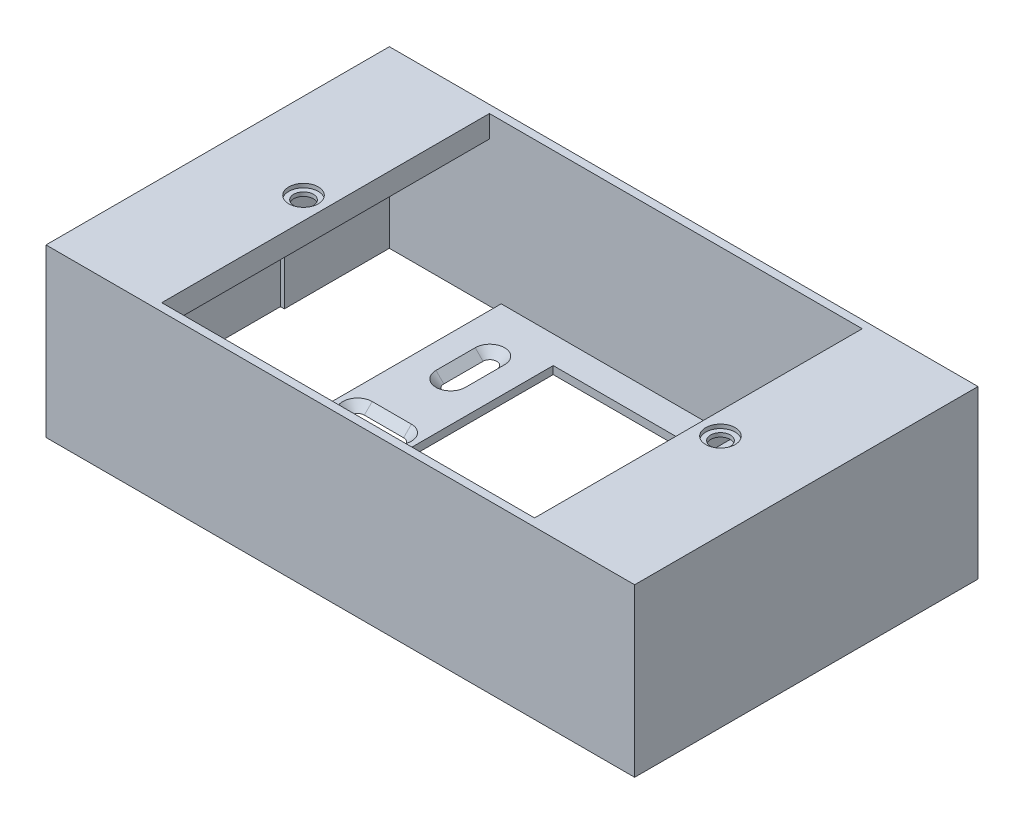
from build123d import *

# Parameters (mm, degrees)
SKETCH1_W                    = 120
SKETCH1_H                    = 70
BOSS_EXTRUDE1_DEPTH          = 34
SHELL1_T                     = -1.6
CUT_EXTRUDE1_REACH           = 79.337
SKETCH2_W                    = 76
SKETCH2_H                    = 66.8
SKETCH3_W                    = 1.6
SKETCH3_H                    = 70
BOSS_EXTRUDE2_DEPTH          = 4.5
SKETCH4_R                    = 3
CUT_EXTRUDE2_DEPTH           = 0.8
CUT_EXTRUDE3_REACH           = 79.337
SKETCH5_R                    = 2
SKETCH7_W                    = 71.2
SKETCH7_H                    = 66.8
SKETCH7_W_2                  = 38.8
SKETCH7_H_2                  = 55.6
BOSS_EXTRUDE3_DEPTH          = 1.6
CUT_EXTRUDE4_DEPTH           = 1.6
CUT_EXTRUDE4_DRAFT           = -45
CUT_EXTRUDE4_PROFILE_2_DEPTH = 1.6
CUT_EXTRUDE4_PROFILE_2_DRAFT = -45
CUT_EXTRUDE4_PROFILE_3_DEPTH = 1.6
CUT_EXTRUDE4_PROFILE_3_DRAFT = -45
CUT_EXTRUDE4_PROFILE_4_DEPTH = 1.6
CUT_EXTRUDE4_PROFILE_4_DRAFT = -45
CUT_EXTRUDE4_PROFILE_5_DEPTH = 1.6
CUT_EXTRUDE4_PROFILE_5_DRAFT = -45
CUT_EXTRUDE4_PROFILE_6_DEPTH = 1.6
CUT_EXTRUDE4_PROFILE_6_DRAFT = -45
CUT_EXTRUDE5_START           = -1.6
SKETCH9_W                    = 24
SKETCH9_H                    = 12
CUT_EXTRUDE5_DEPTH           = 0.8


with BuildPart() as part:
    # Sketch1 → Boss-Extrude1 (new body)
    with BuildSketch(Plane(origin=(0, 0, 0), x_dir=(1, 0, 0), z_dir=(0, 1, 0))):
        Rectangle(SKETCH1_W, SKETCH1_H)
    extrude(amount=BOSS_EXTRUDE1_DEPTH)

    # Shell1
    shell1_openings = [part.faces().sort_by_distance(p)[0] for p in [
        (0, 0, 0),
    ]]
    offset(amount=SHELL1_T, openings=shell1_openings, kind=Kind.INTERSECTION)

    # Sketch2 → Cut-Extrude1 (cut, up to next)
    with BuildSketch(Plane(origin=(0, 34, 0), x_dir=(1, 0, 0), z_dir=(0, 1, 0)), mode=Mode.PRIVATE) as cut_extrude1_sk1:
        Rectangle(SKETCH2_W, SKETCH2_H)
    cut_extrude1_tool1 = extrude(cut_extrude1_sk1.sketch, amount=-CUT_EXTRUDE1_REACH, mode=Mode.PRIVATE) & part.part
    add(cut_extrude1_tool1.solids().sort_by_distance((0, 34, 0))[0], mode=Mode.SUBTRACT)

    # Sketch3 → Boss-Extrude2 (add)
    with BuildSketch(Plane(origin=(0, 34, 0), x_dir=(1, 0, 0), z_dir=(0, 1, 0))):
        with Locations((-38.8, 0)):
            Rectangle(SKETCH3_W, SKETCH3_H)
    boss_extrude2 = extrude(amount=-BOSS_EXTRUDE2_DEPTH)

    # Sketch4 → Cut-Extrude2 (cut)
    with BuildSketch(Plane(origin=(0, 34, 0), x_dir=(1, 0, 0), z_dir=(0, 1, 0))):
        with Locations(Location((-42.5, 0, 0), (0, 0, 270))):
            Circle(SKETCH4_R)
    cut_extrude2 = extrude(amount=-CUT_EXTRUDE2_DEPTH, mode=Mode.SUBTRACT)

    # Sketch5 → Cut-Extrude3 (cut, up to next)
    with BuildSketch(Plane(origin=(0, 34, 0), x_dir=(1, 0, 0), z_dir=(0, 1, 0)), mode=Mode.PRIVATE) as cut_extrude3_sk1:
        with Locations(Location((-42.5, 0, 0), (0, 0, 270))):
            Circle(SKETCH5_R)
    cut_extrude3_tool1 = extrude(cut_extrude3_sk1.sketch, amount=-CUT_EXTRUDE3_REACH, mode=Mode.PRIVATE) & part.part
    cut_extrude3 = cut_extrude3_tool1.solids().sort_by_distance((-42.5, 34, 0))[0]
    add(cut_extrude3, mode=Mode.SUBTRACT)

    # Mirror1: Boss-Extrude2, Cut-Extrude2, Cut-Extrude3 across plane
    add(boss_extrude2.mirror(Plane(origin=(0, 0, 0), x_dir=(0, 0, 1), z_dir=(1, 0, 0))))
    add(cut_extrude2.mirror(Plane(origin=(0, 0, 0), x_dir=(0, 0, 1), z_dir=(1, 0, 0))), mode=Mode.SUBTRACT)
    add(cut_extrude3.mirror(Plane(origin=(0, 0, 0), x_dir=(0, 0, 1), z_dir=(1, 0, 0))), mode=Mode.SUBTRACT)

    # Sketch7 → Boss-Extrude3 (add)
    with BuildSketch(Plane(origin=(0, 0, 0), x_dir=(1, 0, 0), z_dir=(0, 1, 0))):
        Rectangle(SKETCH7_W, SKETCH7_H)
        Rectangle(SKETCH7_W_2, SKETCH7_H_2, mode=Mode.SUBTRACT)
    extrude(amount=BOSS_EXTRUDE3_DEPTH)


with BuildPart() as cut_extrude4_tool:
    # Sketch8 → Cut-Extrude4 (with draft: the straight prism first)
    with BuildSketch(Plane(origin=(0, 1.6, 0), x_dir=(1, 0, 0), z_dir=(0, 1, 0))):
        with BuildLine():
            ThreePointArc((-31.5, 3), (-34.5, 0), (-31.5, -3))
            Line((-31.5, -3), (-23.5, -3))
            ThreePointArc((-23.5, -3), (-20.5, 0), (-23.5, 3))
            Line((-23.5, 3), (-31.5, 3))
        make_face()
    extrude(amount=-CUT_EXTRUDE4_DEPTH)
    # Cut-Extrude4: the draft: its side faces are tilted about the plane it starts from
    cut_extrude4_sides = [cut_extrude4_tool.faces().sort_by_distance(p)[0] for p in [
        (-20.5, 0.8, 0),
        (-27.5, 0.8, -3),
        (-34.5, 0.8, 0),
        (-27.5, 0.8, 3),
    ]]
    draft(cut_extrude4_sides, Plane(origin=(0, 1.6, 0), x_dir=(1, 0, 0), z_dir=(0, 1, 0)), CUT_EXTRUDE4_DRAFT)


with BuildPart() as part_1:
    add(part.part)

    # Cut-Extrude4: cut by cut_extrude4_tool
    add(cut_extrude4_tool.part, mode=Mode.SUBTRACT)


with BuildPart() as cut_extrude4_profile_2_tool:
    # Sketch8 → Cut-Extrude4 profile 2 (with draft: the straight prism first)
    with BuildSketch(Plane(origin=(0, 1.6, 0), x_dir=(1, 0, 0), z_dir=(0, 1, 0))):
        with BuildLine():
            ThreePointArc((24.5, -4), (27.5, -7), (30.5, -4))
            Line((30.5, -4), (30.5, 4))
            ThreePointArc((30.5, 4), (27.5, 7), (24.5, 4))
            Line((24.5, 4), (24.5, -4))
        make_face()
    extrude(amount=-CUT_EXTRUDE4_PROFILE_2_DEPTH)
    # Cut-Extrude4 profile 2: the draft: its side faces are tilted about the plane it starts from
    cut_extrude4_profile_2_sides = [cut_extrude4_profile_2_tool.faces().sort_by_distance(p)[0] for p in [
        (27.5, 0.8, -7),
        (24.5, 0.8, 0),
        (27.5, 0.8, 7),
        (30.5, 0.8, 0),
    ]]
    draft(cut_extrude4_profile_2_sides, Plane(origin=(0, 1.6, 0), x_dir=(1, 0, 0), z_dir=(0, 1, 0)), CUT_EXTRUDE4_PROFILE_2_DRAFT)


with BuildPart() as part_2:
    add(part_1.part)

    # Cut-Extrude4 profile 2: cut by cut_extrude4_profile_2_tool
    add(cut_extrude4_profile_2_tool.part, mode=Mode.SUBTRACT)


with BuildPart() as cut_extrude4_profile_3_tool:
    # Sketch8 → Cut-Extrude4 profile 3 (with draft: the straight prism first)
    with BuildSketch(Plane(origin=(0, 1.6, 0), x_dir=(1, 0, 0), z_dir=(0, 1, 0))):
        with BuildLine():
            ThreePointArc((23.5, 22), (20.5, 19), (23.5, 16))
            Line((23.5, 16), (31.5, 16))
            ThreePointArc((31.5, 16), (34.5, 19), (31.5, 22))
            Line((31.5, 22), (23.5, 22))
        make_face()
    extrude(amount=-CUT_EXTRUDE4_PROFILE_3_DEPTH)
    # Cut-Extrude4 profile 3: the draft: its side faces are tilted about the plane it starts from
    cut_extrude4_profile_3_sides = [cut_extrude4_profile_3_tool.faces().sort_by_distance(p)[0] for p in [
        (34.5, 0.8, -19),
        (27.5, 0.8, -22),
        (20.5, 0.8, -19),
        (27.5, 0.8, -16),
    ]]
    draft(cut_extrude4_profile_3_sides, Plane(origin=(0, 1.6, 0), x_dir=(1, 0, 0), z_dir=(0, 1, 0)), CUT_EXTRUDE4_PROFILE_3_DRAFT)


with BuildPart() as part_3:
    add(part_2.part)

    # Cut-Extrude4 profile 3: cut by cut_extrude4_profile_3_tool
    add(cut_extrude4_profile_3_tool.part, mode=Mode.SUBTRACT)


with BuildPart() as cut_extrude4_profile_4_tool:
    # Sketch8 → Cut-Extrude4 profile 4 (with draft: the straight prism first)
    with BuildSketch(Plane(origin=(0, 1.6, 0), x_dir=(1, 0, 0), z_dir=(0, 1, 0))):
        with BuildLine():
            ThreePointArc((23.5, -16), (20.5, -19), (23.5, -22))
            Line((23.5, -22), (31.5, -22))
            ThreePointArc((31.5, -22), (34.5, -19), (31.5, -16))
            Line((31.5, -16), (23.5, -16))
        make_face()
    extrude(amount=-CUT_EXTRUDE4_PROFILE_4_DEPTH)
    # Cut-Extrude4 profile 4: the draft: its side faces are tilted about the plane it starts from
    cut_extrude4_profile_4_sides = [cut_extrude4_profile_4_tool.faces().sort_by_distance(p)[0] for p in [
        (34.5, 0.8, 19),
        (27.5, 0.8, 16),
        (20.5, 0.8, 19),
        (27.5, 0.8, 22),
    ]]
    draft(cut_extrude4_profile_4_sides, Plane(origin=(0, 1.6, 0), x_dir=(1, 0, 0), z_dir=(0, 1, 0)), CUT_EXTRUDE4_PROFILE_4_DRAFT)


with BuildPart() as part_4:
    add(part_3.part)

    # Cut-Extrude4 profile 4: cut by cut_extrude4_profile_4_tool
    add(cut_extrude4_profile_4_tool.part, mode=Mode.SUBTRACT)


with BuildPart() as cut_extrude4_profile_5_tool:
    # Sketch8 → Cut-Extrude4 profile 5 (with draft: the straight prism first)
    with BuildSketch(Plane(origin=(0, 1.6, 0), x_dir=(1, 0, 0), z_dir=(0, 1, 0))):
        with BuildLine():
            ThreePointArc((-30.5, 15), (-27.5, 12), (-24.5, 15))
            Line((-24.5, 15), (-24.5, 23))
            ThreePointArc((-24.5, 23), (-27.5, 26), (-30.5, 23))
            Line((-30.5, 23), (-30.5, 15))
        make_face()
    extrude(amount=-CUT_EXTRUDE4_PROFILE_5_DEPTH)
    # Cut-Extrude4 profile 5: the draft: its side faces are tilted about the plane it starts from
    cut_extrude4_profile_5_sides = [cut_extrude4_profile_5_tool.faces().sort_by_distance(p)[0] for p in [
        (-24.5, 0.8, -19),
        (-27.5, 0.8, -26),
        (-30.5, 0.8, -19),
        (-27.5, 0.8, -12),
    ]]
    draft(cut_extrude4_profile_5_sides, Plane(origin=(0, 1.6, 0), x_dir=(1, 0, 0), z_dir=(0, 1, 0)), CUT_EXTRUDE4_PROFILE_5_DRAFT)


with BuildPart() as part_5:
    add(part_4.part)

    # Cut-Extrude4 profile 5: cut by cut_extrude4_profile_5_tool
    add(cut_extrude4_profile_5_tool.part, mode=Mode.SUBTRACT)


with BuildPart() as cut_extrude4_profile_6_tool:
    # Sketch8 → Cut-Extrude4 profile 6 (with draft: the straight prism first)
    with BuildSketch(Plane(origin=(0, 1.6, 0), x_dir=(1, 0, 0), z_dir=(0, 1, 0))):
        with BuildLine():
            ThreePointArc((-30.5, -23), (-27.5, -26), (-24.5, -23))
            Line((-24.5, -23), (-24.5, -15))
            ThreePointArc((-24.5, -15), (-27.5, -12), (-30.5, -15))
            Line((-30.5, -15), (-30.5, -23))
        make_face()
    extrude(amount=-CUT_EXTRUDE4_PROFILE_6_DEPTH)
    # Cut-Extrude4 profile 6: the draft: its side faces are tilted about the plane it starts from
    cut_extrude4_profile_6_sides = [cut_extrude4_profile_6_tool.faces().sort_by_distance(p)[0] for p in [
        (-27.5, 0.8, 26),
        (-24.5, 0.8, 19),
        (-27.5, 0.8, 12),
        (-30.5, 0.8, 19),
    ]]
    draft(cut_extrude4_profile_6_sides, Plane(origin=(0, 1.6, 0), x_dir=(1, 0, 0), z_dir=(0, 1, 0)), CUT_EXTRUDE4_PROFILE_6_DRAFT)


with BuildPart() as part_6:
    add(part_5.part)

    # Cut-Extrude4 profile 6: cut by cut_extrude4_profile_6_tool
    add(cut_extrude4_profile_6_tool.part, mode=Mode.SUBTRACT)

    # Sketch9 → Cut-Extrude5 (cut)
    with BuildSketch(Plane.ZY.offset(60).offset(CUT_EXTRUDE5_START)):
        with Locations((0, 6)):
            Rectangle(SKETCH9_W, SKETCH9_H)
    cut_extrude5 = extrude(amount=CUT_EXTRUDE5_DEPTH, mode=Mode.SUBTRACT)

    # Mirror2: Cut-Extrude5 across plane
    add(cut_extrude5.mirror(Plane(origin=(0, 0, 0), x_dir=(0, 0, 1), z_dir=(1, 0, 0))), mode=Mode.SUBTRACT)


solid = part_6.part
